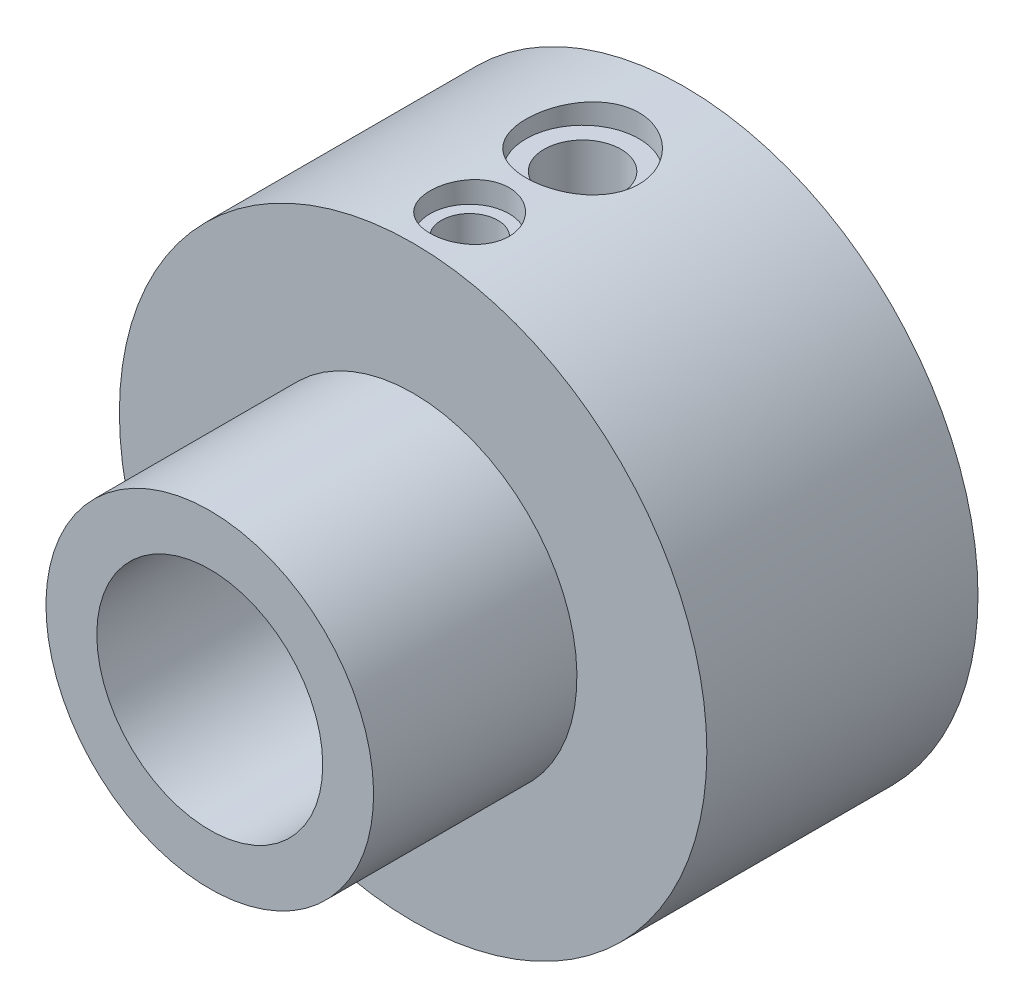
from build123d import *

# Parameters (mm, degrees)
SKETCH2_R                   = 10
CUT_EXTRUDE1_DEPTH          = 56.821142948
CUT_EXTRUDE2_REACH          = 81.821
CUT_EXTRUDE2_END_RADIUS     = 26
CUT_EXTRUDE2_START          = 24
SKETCH3_R                   = 5
SKETCH3_R_2                 = 3.5
M8X1_25_TAPPED_HOLE1_REACH  = 72.285
M8X1_25_TAPPED_HOLE1_BORE_R = 3.4
F_5_0_5_DIAMETER_HOLE1_D    = 5


with BuildPart() as part:
    # Sketch1 → Revolve1 (revolve)
    with BuildSketch(Plane(origin=(0, 0, 0), x_dir=(0, 0, -1), z_dir=(1, 0, 0))):
        Polygon((0, 0), (0, 14.5), (18, 14.5), (18, 26), (42, 26), (42, 0), align=None)
    revolve(axis=Axis((0, 0, -42), (0, 0, 1)))

    # Sketch2 → Cut-Extrude1 (cut, through all)
    with BuildSketch(Plane.XY):
        Circle(SKETCH2_R)
    extrude(amount=-CUT_EXTRUDE1_DEPTH, mode=Mode.SUBTRACT)

    # Cut-Extrude2: up to this cylinder (the profile starts inside it)
    cut_extrude2_end = Plane(origin=(0, 0, -28), z_dir=(0, 0, -1)) * Cylinder(CUT_EXTRUDE2_END_RADIUS, 226.642, mode=Mode.PRIVATE)
    # Sketch3 → Cut-Extrude2 (cut, up to the surface)
    with BuildSketch(Plane(origin=(0, 0, 0), x_dir=(1, 0, 0), z_dir=(0, 1, 0)).offset(CUT_EXTRUDE2_START), mode=Mode.PRIVATE) as cut_extrude2_sk1:
        with Locations(Location((0, 33, 0), (0, 0, 270))):
            Circle(SKETCH3_R)
    cut_extrude2_tool1 = extrude(cut_extrude2_sk1.sketch, amount=CUT_EXTRUDE2_REACH, mode=Mode.PRIVATE) & cut_extrude2_end
    add(cut_extrude2_tool1.solids().sort_by_distance((0, 24, -33))[0], mode=Mode.SUBTRACT)
    # Sketch3 → Cut-Extrude2 (cut, up to the surface)
    with BuildSketch(Plane(origin=(0, 0, 0), x_dir=(1, 0, 0), z_dir=(0, 1, 0)).offset(CUT_EXTRUDE2_START), mode=Mode.PRIVATE) as cut_extrude2_sk2:
        with Locations(Location((0, 23, 0), (0, 0, 270))):
            Circle(SKETCH3_R_2)
    cut_extrude2_tool2 = extrude(cut_extrude2_sk2.sketch, amount=CUT_EXTRUDE2_REACH, mode=Mode.PRIVATE) & cut_extrude2_end
    add(cut_extrude2_tool2.solids().sort_by_distance((0, 24, -23))[0], mode=Mode.SUBTRACT)

    # M8x1.25 Tapped Hole1 bore → M8x1.25 Tapped Hole1 (cut, up to next)
    with BuildSketch(Plane(origin=(0, 24, 0), x_dir=(1, 0, 0), z_dir=(0, 1, 0)), mode=Mode.PRIVATE) as m8x1_25_tapped_hole1_sk1:
        with Locations((0, 33)):
            Circle(M8X1_25_TAPPED_HOLE1_BORE_R)
    m8x1_25_tapped_hole1_tool1 = extrude(m8x1_25_tapped_hole1_sk1.sketch, amount=-M8X1_25_TAPPED_HOLE1_REACH, mode=Mode.PRIVATE) & part.part
    add(m8x1_25_tapped_hole1_tool1.solids().sort_by_distance((0, 24, -33))[0], mode=Mode.SUBTRACT)

    # Ø5.0 (5) Diameter Hole1 (through all)
    with Locations(Plane(origin=(0, 24, 0), x_dir=(1, 0, 0), z_dir=(0, 1, 0))):
        with Locations((0, 23)):
            Hole(F_5_0_5_DIAMETER_HOLE1_D / 2)


solid = part.part
